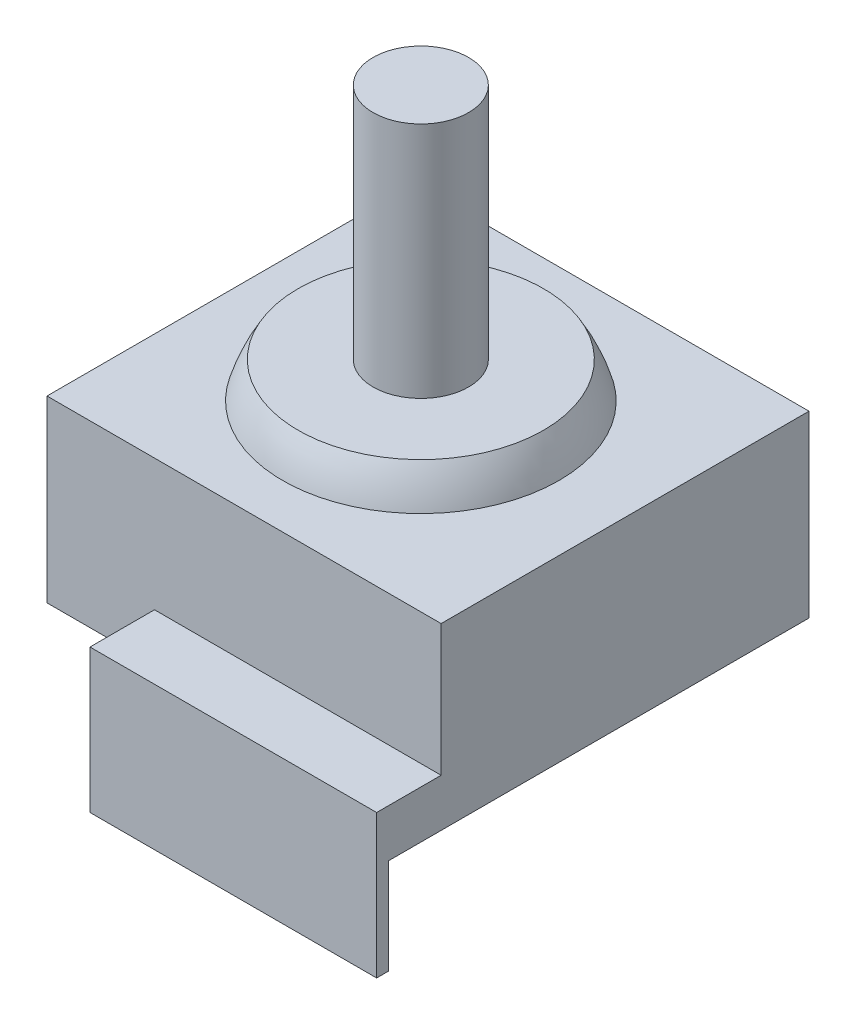
from build123d import *

# Parameters (mm, degrees)
SKETCH_1_W      = 16.5
SKETCH_1_H      = 15.4
SKETCH_1_R      = 0.5
EXTRUDE_1_DEPTH = 7.5
SKETCH_2_W      = 12
SKETCH_2_H      = 2.7
EXTRUDE_2_DEPTH = 2
SKETCH_3_W      = 12
SKETCH_3_H      = 0.5
EXTRUDE_3_DEPTH = 6
SKETCH_4_R      = 2
EXTRUDE_4_DEPTH = 11.45


with BuildPart() as part:
    # 草图1 → 凸台-拉伸1 (new body)
    with BuildSketch(Plane(origin=(0, 0, 0), x_dir=(1, 0, 0), z_dir=(0, 1, 0))):
        with Locations((0.25, 0.05)):
            Rectangle(SKETCH_1_W, SKETCH_1_H)
        with Locations(Location((0, 0, 0), (0, 0, 270))):
            Circle(SKETCH_1_R, mode=Mode.SUBTRACT)
    extrude(amount=EXTRUDE_1_DEPTH)

    # 草图2 → 凸台-拉伸2 (add)
    with BuildSketch(Plane.XZ):
        with Locations((2.5, 9)):
            Rectangle(SKETCH_2_W, SKETCH_2_H)
    extrude(amount=-EXTRUDE_2_DEPTH)

    # 草图3 → 凸台-拉伸3 (add)
    with BuildSketch(Plane(origin=(0, 2, 0), x_dir=(1, 0, 0), z_dir=(0, 1, 0))):
        with Locations((2.5, -10.1)):
            Rectangle(SKETCH_3_W, SKETCH_3_H)
    extrude(amount=-EXTRUDE_3_DEPTH)

    # 草图4 → 凸台-拉伸4 (add)
    with BuildSketch(Plane(origin=(0, 7.5, 0), x_dir=(1, 0, 0), z_dir=(0, 1, 0))):
        with Locations(Location((0, 0, 0), (0, 0, 270))):
            Circle(SKETCH_4_R)
    extrude(amount=EXTRUDE_4_DEPTH)

    # 草图5 → 旋转1 (revolve)
    with BuildSketch(Plane.XY):
        with BuildLine():
            Line((0, 9), (5.137119816, 9))
            ThreePointArc((5.137119816, 9), (5.780256002, 7.508925279), (6, 5.9))
            Line((6, 5.9), (0, 5.9))
            Line((0, 5.9), (0, 9))
        make_face()
    revolve(axis=Axis((0, 0, 0), (0, 1, 0)))


solid = part.part
